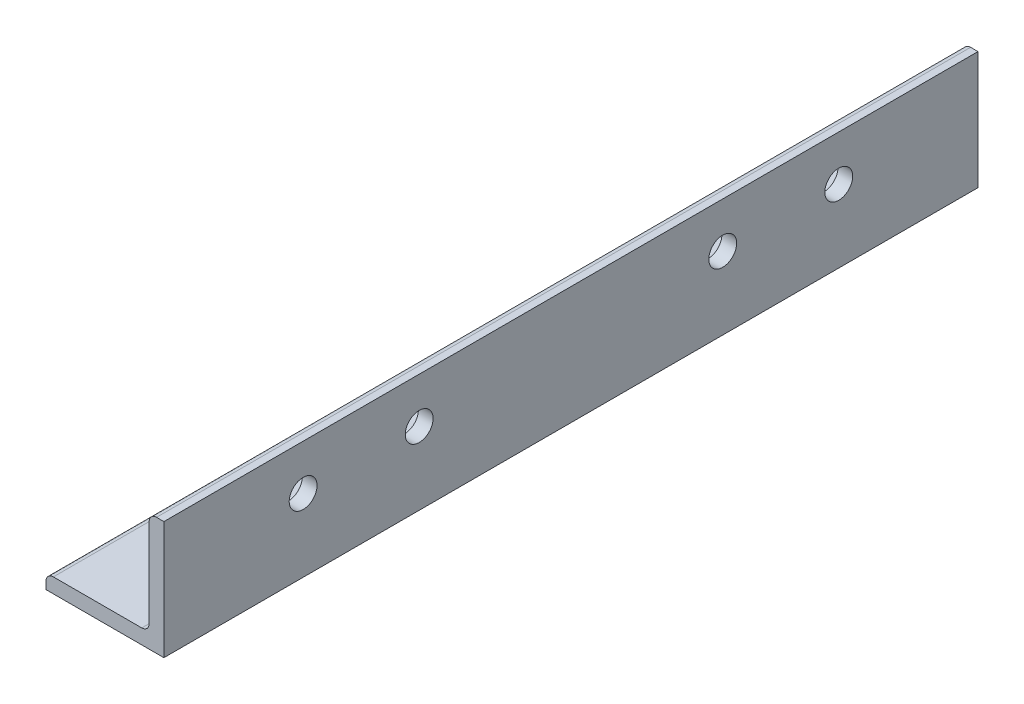
from build123d import *

# Parameters (mm, degrees)
BOSS_EXTRUDE1_DEPTH = 87.698453
SKETCH3_R           = 3.175
CUT_EXTRUDE1_DEPTH  = 93.181715424
SKETCH4_R           = 3
CUT_EXTRUDE2_DEPTH  = 94.968767596


with BuildPart() as part:
    # Sketch2 → Boss-Extrude1 (new, symmetric)
    with BuildSketch(Plane.XY):
        with BuildLine():
            Line((-12.7, 0), (12.7, 0))
            Line((12.7, 0), (12.7, 25.4))
            Line((12.7, 25.4), (11.1125, 25.4))
            ThreePointArc((11.1125, 25.4), (9.989967985, 24.935032015), (9.525, 23.8125))
            Line((9.525, 23.8125), (9.525, 4.7625))
            ThreePointArc((9.525, 4.7625), (9.060032015, 3.639967985), (7.9375, 3.175))
            Line((7.9375, 3.175), (-11.1125, 3.175))
            ThreePointArc((-11.1125, 3.175), (-12.235032015, 2.710032015), (-12.7, 1.5875))
            Line((-12.7, 1.5875), (-12.7, 0))
        make_face()
    extrude(amount=BOSS_EXTRUDE1_DEPTH, both=True)

    # Sketch3 → Cut-Extrude1 (cut, through all)
    with BuildSketch(Plane.XZ):
        with Locations(Location((0, -37.698453, 0), (0, 0, 270))):
            Circle(SKETCH3_R)
        with Locations((0, 37.698453)):
            Circle(SKETCH3_R)
    extrude(amount=-CUT_EXTRUDE1_DEPTH, mode=Mode.SUBTRACT)

    # Sketch4 → Cut-Extrude2 (cut, through all)
    with BuildSketch(Plane.ZY.offset(-9.525)):
        with Locations((-57.698453, 15.647712404)):
            Circle(SKETCH4_R)
        with Locations((-32.698453, 15.647712404)):
            Circle(SKETCH4_R)
        with Locations(Location((57.698453, 15.647712404, 0), (0, 0, 180))):
            Circle(SKETCH4_R)
        with Locations(Location((32.698453, 15.647712404, 0), (0, 0, 180))):
            Circle(SKETCH4_R)
    extrude(amount=-CUT_EXTRUDE2_DEPTH, mode=Mode.SUBTRACT)


solid = part.part
